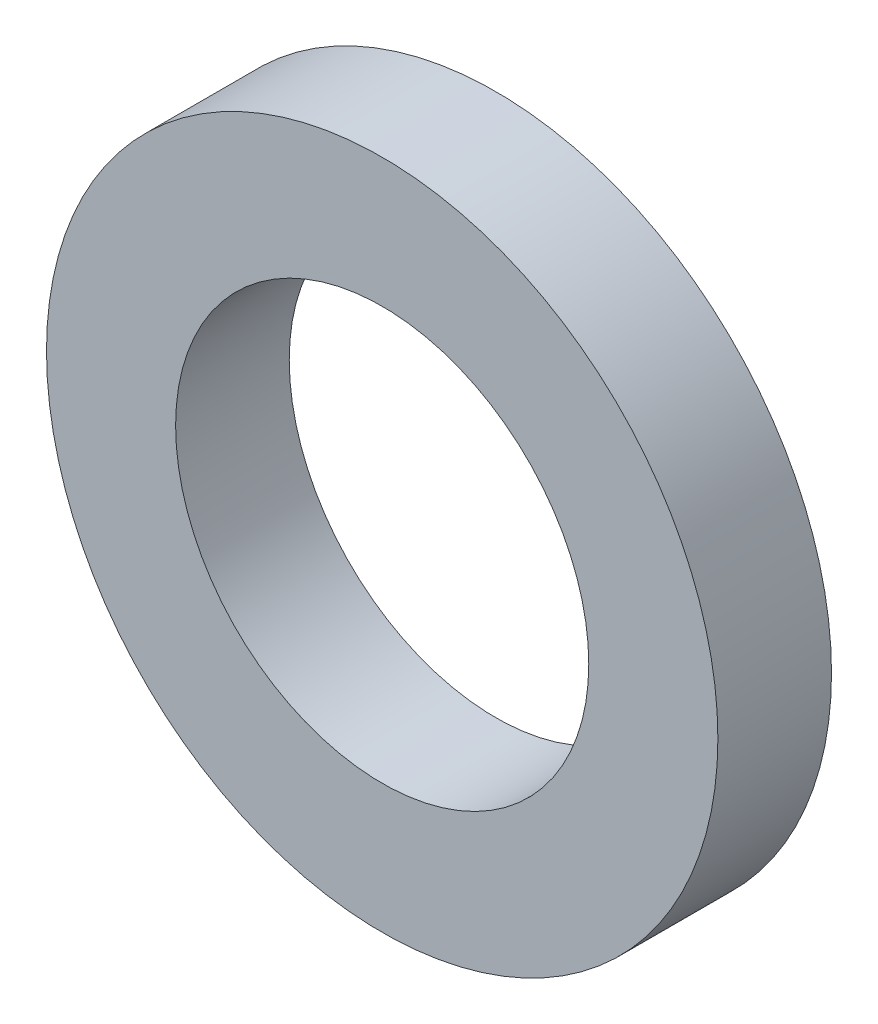
from build123d import *

# Parameters (mm, degrees)
SKETCH_1_R      = 3.25
SKETCH_1_R_2    = 2
EXTRUDE_1_DEPTH = 1.1


with BuildPart() as part:
    # 草图1 → 凸台-拉伸1 (new body)
    with BuildSketch(Plane.XY):
        Circle(SKETCH_1_R)
        Circle(SKETCH_1_R_2, mode=Mode.SUBTRACT)
    extrude(amount=EXTRUDE_1_DEPTH)


solid = part.part
